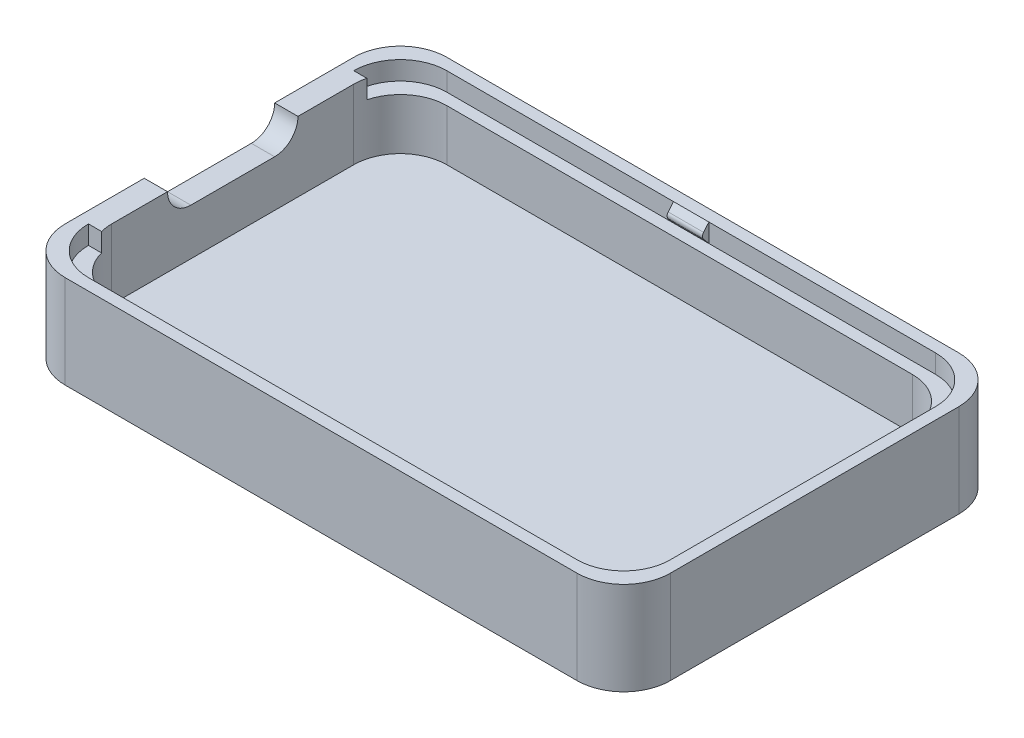
from build123d import *

# Parameters (mm, degrees)
BOSS_EXTRUDE1_DEPTH      = 10
BOSS_EXTRUDE2_DEPTH      = 2.5
CUT_EXTRUDE2_START       = -2
CUT_EXTRUDE2_DEPTH       = 2
BOSS_EXTRUDE3_DEPTH      = 1.9
BOSS_EXTRUDE3_DEPTH_BACK = 1.9
CUT_EXTRUDE3_DEPTH       = 5
CUT_EXTRUDE3_DEPTH_BACK  = 5
CUT_EXTRUDE4_DEPTH       = 10


with BuildPart() as part:
    # Sketch1 → Boss-Extrude1 (new body)
    with BuildSketch(Plane(origin=(0, 0, 0), x_dir=(1, 0, 0), z_dir=(0, 1, 0))):
        with BuildLine():
            Line((5, 0), (60, 0))
            ThreePointArc((60, 0), (63.535533906, 1.464466094), (65, 5))
            Line((65, 5), (65, 36))
            ThreePointArc((65, 36), (63.535533906, 39.535533906), (60, 41))
            Line((60, 41), (5, 41))
            ThreePointArc((5, 41), (1.464466094, 39.535533906), (0, 36))
            Line((0, 36), (0, 5))
            ThreePointArc((0, 5), (1.464466094, 1.464466094), (5, 0))
        make_face()
        with BuildLine():
            Line((7.5, 38.5), (57.5, 38.5))
            ThreePointArc((57.5, 38.5), (61.035533906, 37.035533906), (62.5, 33.5))
            Line((62.5, 33.5), (62.5, 7.5))
            ThreePointArc((62.5, 7.5), (61.035533906, 3.964466094), (57.5, 2.5))
            Line((57.5, 2.5), (7.5, 2.5))
            ThreePointArc((7.5, 2.5), (3.964466094, 3.964466094), (2.5, 7.5))
            Line((2.5, 7.5), (2.5, 33.5))
            ThreePointArc((2.5, 33.5), (3.964466094, 37.035533906), (7.5, 38.5))
        make_face(mode=Mode.SUBTRACT)
    extrude(amount=BOSS_EXTRUDE1_DEPTH)

    # Sketch2 → Boss-Extrude2 (add)
    with BuildSketch(Plane(origin=(0, 0, 0), x_dir=(1, 0, 0), z_dir=(0, 1, 0))):
        with BuildLine():
            Line((7.5, 38.5), (57.5, 38.5))
            ThreePointArc((57.5, 38.5), (61.035533906, 37.035533906), (62.5, 33.5))
            Line((62.5, 33.5), (62.5, 7.5))
            ThreePointArc((62.5, 7.5), (61.035533906, 3.964466094), (57.5, 2.5))
            Line((57.5, 2.5), (7.5, 2.5))
            ThreePointArc((7.5, 2.5), (3.964466094, 3.964466094), (2.5, 7.5))
            Line((2.5, 7.5), (2.5, 33.5))
            ThreePointArc((2.5, 33.5), (3.964466094, 37.035533906), (7.5, 38.5))
        make_face()
    extrude(amount=BOSS_EXTRUDE2_DEPTH)

    # Sketch4 → Cut-Extrude2 (cut)
    with BuildSketch(Plane(origin=(0, 10, 0), x_dir=(1, 0, 0), z_dir=(0, 1, 0)).offset(CUT_EXTRUDE2_START)):
        with BuildLine():
            Line((6.25, 39.75), (58.75, 39.75))
            ThreePointArc((58.75, 39.75), (62.285533906, 38.285533906), (63.75, 34.75))
            Line((63.75, 34.75), (63.75, 6.25))
            ThreePointArc((63.75, 6.25), (62.285533906, 2.714466094), (58.75, 1.25))
            Line((58.75, 1.25), (6.25, 1.25))
            ThreePointArc((6.25, 1.25), (2.714466094, 2.714466094), (1.25, 6.25))
            Line((1.25, 6.25), (2.658770817, 6.25))
            ThreePointArc((2.658770817, 6.25), (4.438137822, 3.547152925), (7.5, 2.5))
            Line((7.5, 2.5), (57.5, 2.5))
            ThreePointArc((57.5, 2.5), (61.035533906, 3.964466094), (62.5, 7.5))
            Line((62.5, 7.5), (62.5, 33.5))
            ThreePointArc((62.5, 33.5), (61.035533906, 37.035533906), (57.5, 38.5))
            Line((57.5, 38.5), (7.5, 38.5))
            ThreePointArc((7.5, 38.5), (4.438137822, 37.452847075), (2.658770817, 34.75))
            Line((2.658770817, 34.75), (1.25, 34.75))
            ThreePointArc((1.25, 34.75), (2.714466094, 38.285533906), (6.25, 39.75))
        make_face()
    extrude(amount=CUT_EXTRUDE2_DEPTH, mode=Mode.SUBTRACT)

    # Sketch5 → Boss-Extrude3 (add, two sides: drawn at the far end of the back side and taken through both)
    with BuildSketch(Plane(origin=(32.5, 0, 0), x_dir=(0, 0, -1), z_dir=(1, 0, 0)).offset(-BOSS_EXTRUDE3_DEPTH_BACK)):
        with BuildLine():
            Line((1.25, 10), (1.25, 8))
            Line((1.25, 8), (1.81941821, 8.678606187))
            ThreePointArc((1.81941821, 8.678606187), (1.936395991, 8.999999993), (1.819418212, 9.3213938))
            Line((1.819418212, 9.3213938), (1.25, 10))
        make_face()
        with BuildLine():
            Line((39.180581788, 9.3213938), (39.75, 10))
            Line((39.75, 10), (39.75, 8))
            Line((39.75, 8), (39.18058179, 8.678606187))
            ThreePointArc((39.18058179, 8.678606187), (39.063604009, 8.999999993), (39.180581788, 9.3213938))
        make_face()
    extrude(amount=BOSS_EXTRUDE3_DEPTH + BOSS_EXTRUDE3_DEPTH_BACK)

    # Sketch6 → Cut-Extrude3 (cut, two sides: drawn at the far end of the back side and taken through both)
    with BuildSketch(Plane(origin=(32.5, 0, 0), x_dir=(0, 0, -1), z_dir=(1, 0, 0)).offset(-CUT_EXTRUDE3_DEPTH_BACK)):
        Polygon((10, 0), (8.75, 1.25), (7.5, 0), align=None)
    extrude(amount=CUT_EXTRUDE3_DEPTH + CUT_EXTRUDE3_DEPTH_BACK, mode=Mode.SUBTRACT)

    # Sketch3 → Cut-Extrude4 (cut)
    with BuildSketch(Plane(origin=(0, 0, 0), x_dir=(0, 0, -1), z_dir=(1, 0, 0))):
        with BuildLine():
            Line((25.000032513, 7.494104603), (15.999967487, 7.494104603))
            ThreePointArc((15.999967487, 7.494104603), (13.49407209, 10), (15.999967487, 12.505895397))
            Line((15.999967487, 12.505895397), (25.000032513, 12.505895397))
            ThreePointArc((25.000032513, 12.505895397), (27.50592791, 10), (25.000032513, 7.494104603))
        make_face()
    extrude(amount=CUT_EXTRUDE4_DEPTH, mode=Mode.SUBTRACT)


solid = part.part
